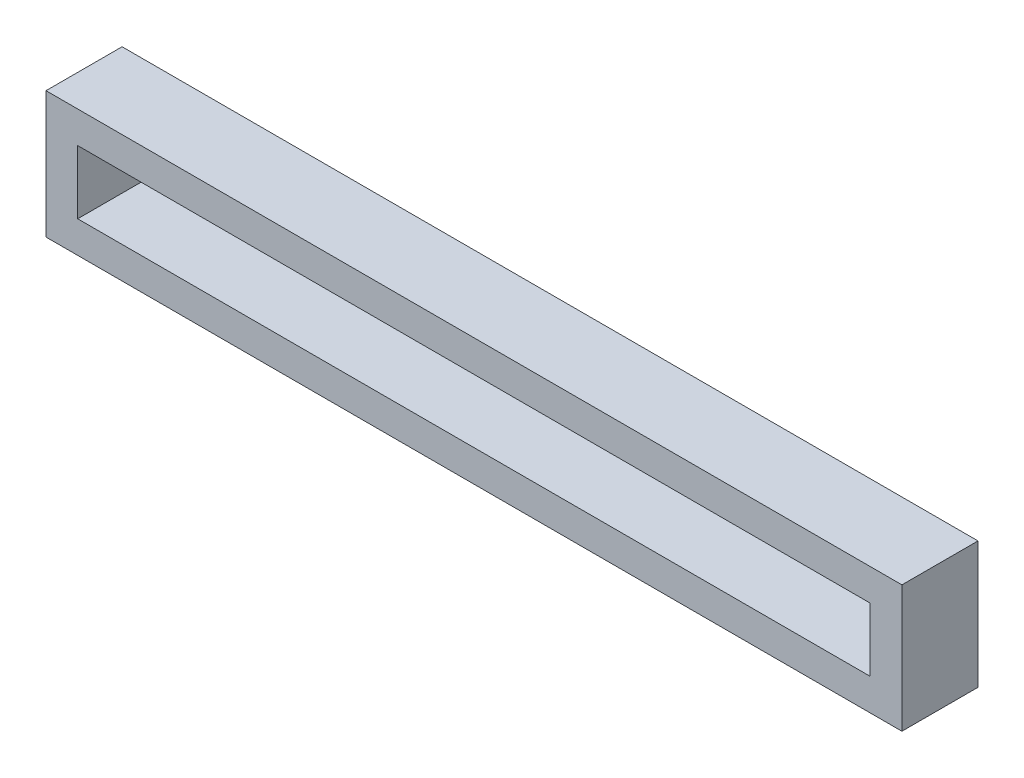
from build123d import *

# Parameters (mm, degrees)
CROQUIS1_W              = 135
CROQUIS1_H              = 20
CROQUIS1_W_2            = 125
CROQUIS1_H_2            = 10
SALIENTE_EXTRUIR1_DEPTH = 10
CROQUIS2_W              = 135
CROQUIS2_H              = 20
SALIENTE_EXTRUIR2_DEPTH = 2


with BuildPart() as part:
    # Croquis1 → Saliente-Extruir1 (new body)
    with BuildSketch(Plane.XY):
        with Locations((62.5, 5)):
            Rectangle(CROQUIS1_W, CROQUIS1_H)
        with Locations((62.5, 5)):
            Rectangle(CROQUIS1_W_2, CROQUIS1_H_2, mode=Mode.SUBTRACT)
    extrude(amount=SALIENTE_EXTRUIR1_DEPTH)

    # Croquis2 → Saliente-Extruir2 (add)
    with BuildSketch(Plane(origin=(0, 0, 0), x_dir=(-1, 0, 0), z_dir=(0, 0, -1))):
        with Locations((-62.5, 5)):
            Rectangle(CROQUIS2_W, CROQUIS2_H)
    extrude(amount=SALIENTE_EXTRUIR2_DEPTH)


solid = part.part
